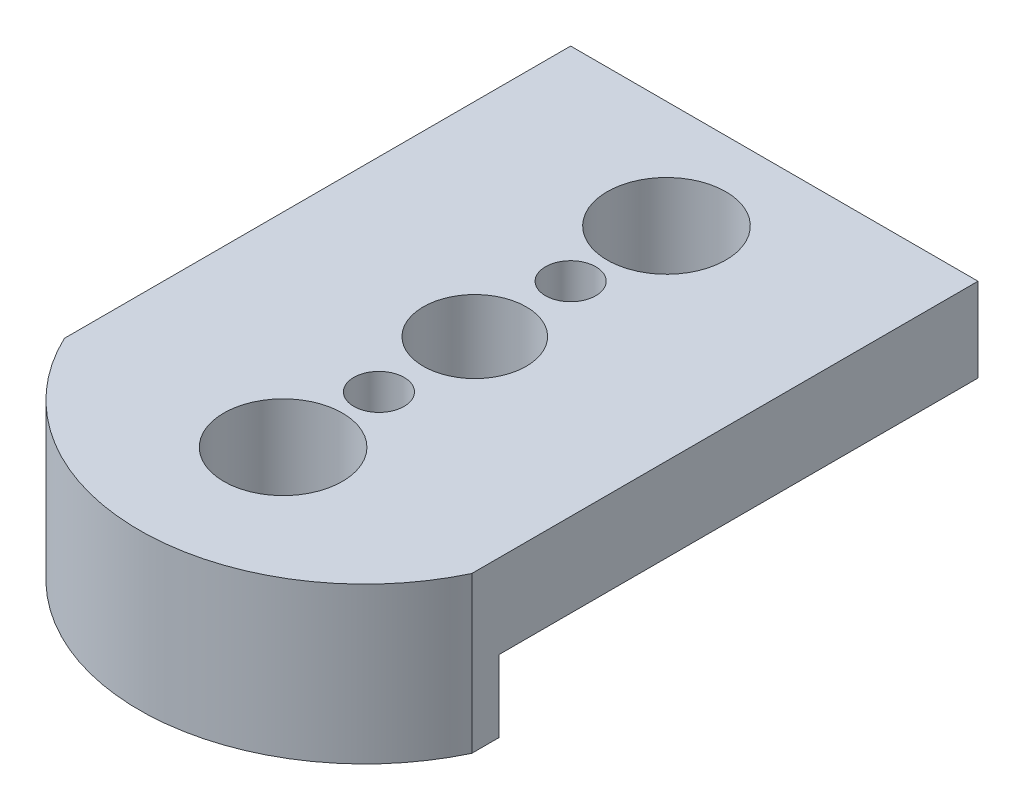
from build123d import *

# Parameters (mm, degrees)
SKETCH1_W           = 34
SKETCH1_H           = 58
BOSS_EXTRUDE1_DEPTH = 13
CUT_EXTRUDE1_DEPTH  = 2.7
SKETCH5_R           = 4.3
CUT_EXTRUDE2_DEPTH  = 36.158071619
CUT_EXTRUDE3_DEPTH  = 45
CUT_EXTRUDE4_DEPTH  = 37.041642582
SKETCH9_R           = 1.1
CUT_EXTRUDE5_DEPTH  = 13
SKETCH10_R          = 2.1
CUT_EXTRUDE6_DEPTH  = 3
SKETCH12_W          = 34
SKETCH12_H          = 5
CUT_EXTRUDE7_DEPTH  = 15


with BuildPart() as part:
    # Sketch1 → Boss-Extrude1 (new body)
    with BuildSketch(Plane(origin=(0, 0, 0), x_dir=(1, 0, 0), z_dir=(0, 1, 0))):
        Rectangle(SKETCH1_W, SKETCH1_H)
    extrude(amount=BOSS_EXTRUDE1_DEPTH)

    # Sketch3 → Cut-Revolve1 (revolve, cut)
    with BuildSketch(Plane(origin=(0, 0, 0), x_dir=(0, 0, -1), z_dir=(1, 0, 0)), mode=Mode.PRIVATE) as cut_revolve1_sk:
        Polygon((-17, 13), (-12.05, 13), (-12.05, 2.6), (-10.6, 2.6), (-10.6, 0), (-17, 0), align=None)
    revolve(cut_revolve1_sk.sketch.rotate(Axis((0, 13, 17), (0, -1, 0)), 180), axis=Axis((0, 13, 17), (0, -1, 0)), mode=Mode.SUBTRACT)

    # Sketch4 → Cut-Extrude1 (cut)
    with BuildSketch(Plane.XZ):
        Polygon((3.70947548, -5.425), (7.418950959, 1), (3.70947548, 7.425), (-3.70947548, 7.425), (-7.418950959, 1), (-3.70947548, -5.425), align=None)
    extrude(amount=-CUT_EXTRUDE1_DEPTH, mode=Mode.SUBTRACT)

    # Sketch5 → Cut-Extrude2 (cut, through all)
    with BuildSketch(Plane.XZ.offset(-2.7)):
        with Locations(Location((0, 1, 0), (0, 0, 270))):
            Circle(SKETCH5_R)
    extrude(amount=-CUT_EXTRUDE2_DEPTH, mode=Mode.SUBTRACT)

    # Sketch6 → Cut-Extrude3 (cut)
    with BuildSketch(Plane(origin=(0, 0, -29), x_dir=(-1, 0, 0), z_dir=(0, 0, -1))):
        Polygon((-17, 6), (-14, 6), (-14, 9), (-6.699377385, 9), (-8.8, 6), (-8.8, 0), (-17, 0), align=None)
        Polygon((8.8, 0), (17, 0), (17, 6), (14, 6), (14, 9), (6.699377385, 9), (8.8, 6), align=None)
    extrude(amount=-CUT_EXTRUDE3_DEPTH, mode=Mode.SUBTRACT)

    # Sketch7 → Cut-Extrude4 (cut, through all)
    with BuildSketch(Plane(origin=(0, 13, 0), x_dir=(1, 0, 0), z_dir=(0, 1, 0))):
        with BuildLine():
            Line((17, -29), (17, -18.253317763))
            ThreePointArc((17, -18.253317763), (10.05598304, -26.088042865), (1.4e-08, -29))
            Line((1.4e-08, -29), (17, -29))
        make_face()
        with BuildLine():
            Line((-17, -29), (1.4e-08, -29))
            ThreePointArc((1.4e-08, -29), (-10.055983028, -26.088042873), (-17, -18.253317763))
            Line((-17, -18.253317763), (-17, -29))
        make_face()
    extrude(amount=-CUT_EXTRUDE4_DEPTH, mode=Mode.SUBTRACT)

    # Sketch11 → Cut-Revolve2 (revolve, cut)
    with BuildSketch(Plane(origin=(0, 0, 0), x_dir=(0, 0, -1), z_dir=(1, 0, 0))):
        Polygon((15, 0), (15, 13), (19.95, 13), (19.95, 2.6), (21.4, 2.6), (21.4, 0), align=None)
    revolve(axis=Axis((0, 0, -15), (0, 1, 0)), mode=Mode.SUBTRACT)

    # Sketch9 → Cut-Extrude5 (cut)
    with BuildSketch(Plane.XZ):
        with Locations(Location((0, -7, 0), (0, 0, 270))):
            Circle(SKETCH9_R)
        with Locations(Location((0, 9, 0), (0, 0, 270))):
            Circle(SKETCH9_R)
    extrude(amount=-CUT_EXTRUDE5_DEPTH, mode=Mode.SUBTRACT)

    # Sketch10 → Cut-Extrude6 (cut)
    with BuildSketch(Plane(origin=(0, 13, 0), x_dir=(1, 0, 0), z_dir=(0, 1, 0))):
        with Locations(Location((0, 7, 0), (0, 0, 270))):
            Circle(SKETCH10_R)
        with Locations(Location((0, -9, 0), (0, 0, 270))):
            Circle(SKETCH10_R)
    extrude(amount=-CUT_EXTRUDE6_DEPTH, mode=Mode.SUBTRACT)

    # Sketch12 → Cut-Extrude7 (cut)
    with BuildSketch(Plane(origin=(0, 13, 0), x_dir=(1, 0, 0), z_dir=(0, 1, 0))):
        with Locations((0, 26.5)):
            Rectangle(SKETCH12_W, SKETCH12_H)
    extrude(amount=-CUT_EXTRUDE7_DEPTH, mode=Mode.SUBTRACT)


solid = part.part
